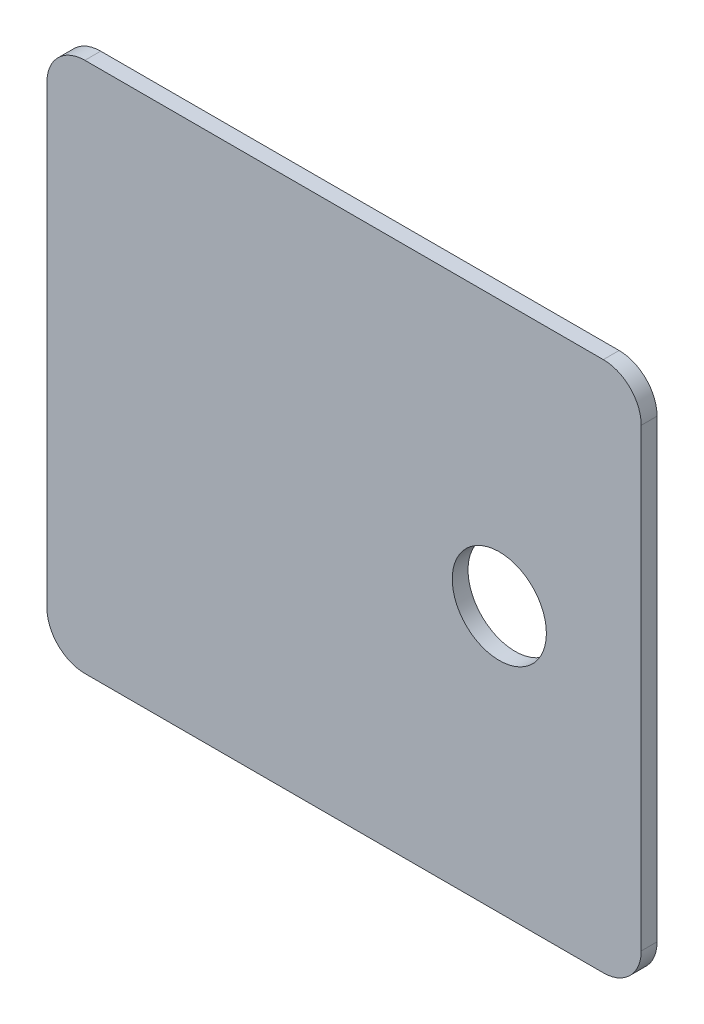
from build123d import *

# Parameters (mm, degrees)
CROQUIS1_W              = 94
CROQUIS1_H              = 84
CROQUIS1_R              = 7.445624545
SALIENTE_EXTRUIR1_DEPTH = 2.5
REDONDEO1_R             = 6


with BuildPart() as part:
    # Croquis1 → Saliente-Extruir1 (new body)
    with BuildSketch(Plane.XY):
        with Locations((-17.9, 28.75)):
            Rectangle(CROQUIS1_W, CROQUIS1_H)
        with Locations((6.65, 28.75)):
            Circle(CROQUIS1_R, mode=Mode.SUBTRACT)
    extrude(amount=SALIENTE_EXTRUIR1_DEPTH)

    # Redondeo1
    redondeo1_edges = [part.edges().sort_by_distance(p)[0] for p in [
        (-64.9, 70.75, 1.25),
        (29.1, 70.75, 1.25),
        (29.1, -13.25, 1.25),
        (-64.9, -13.25, 1.25),
    ]]
    fillet(redondeo1_edges, radius=REDONDEO1_R)


solid = part.part
